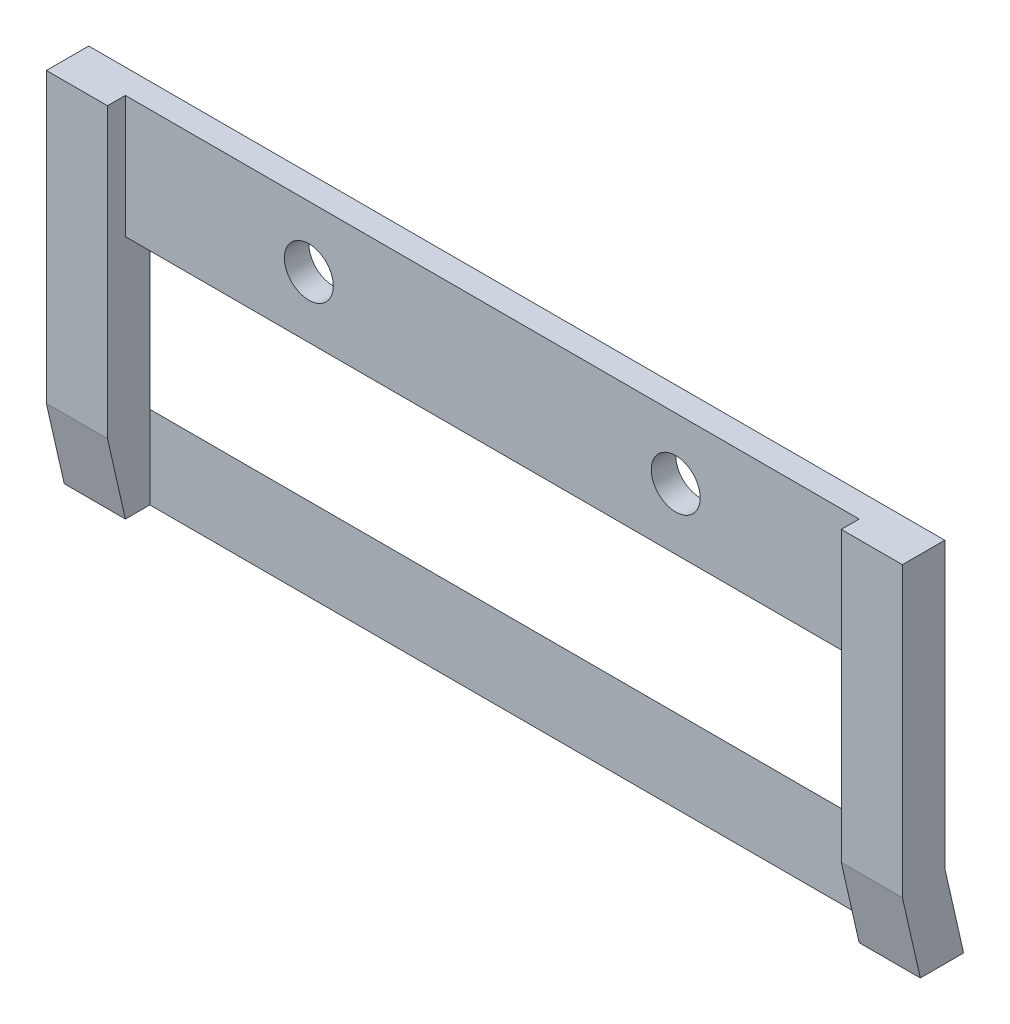
from build123d import *

# Parameters (mm, degrees)
EXTRUDE_1_DEPTH     = 2
EXTRUDE_2_DEPTH     = 5
EXTRUDE_3_DEPTH     = 5
SKETCH_4_R          = 2
CUT_EXTRUDE_1_DEPTH = 10
EXTRUDE_START       = -70
EXTRUDE_4_DEPTH     = 70


with BuildPart() as part:
    # 草图1 → 凸台-拉伸1 (new body)
    with BuildSketch(Plane.XY):
        Polygon((-44.754893935, 0), (15.245106065, 0), (15.245106065, -20), (20.245106065, -20), (20.245106065, 10), (15.245106065, 10), (-44.754893935, 10), (-49.754893935, 10), (-49.754893935, -20), (-44.754893935, -20), align=None)
    extrude(amount=EXTRUDE_1_DEPTH)

    # 草图2 → 凸台-拉伸2 (add)
    with BuildSketch(Plane.ZY.offset(49.754893935)):
        Polygon((0, 10), (0, -20), (2, -20), (3.461164558, -13.577882357), (3.461164558, 10), align=None)
    extrude(amount=-EXTRUDE_2_DEPTH)

    # 草图3 → 凸台-拉伸3 (add)
    with BuildSketch(Plane(origin=(20.245106065, 0, 0), x_dir=(0, 0, -1), z_dir=(1, 0, 0))):
        Polygon((-2, 10), (-3.461164558, 10), (-3.461164558, -13.577882357), (-2, -20), align=None)
    extrude(amount=-EXTRUDE_3_DEPTH)

    # 草图4 → 切除-拉伸1 (cut)
    with BuildSketch(Plane.XY.offset(2)):
        with Locations((-29.754893935, 5)):
            Circle(SKETCH_4_R)
    cut_extrude_1 = extrude(amount=-CUT_EXTRUDE_1_DEPTH, mode=Mode.SUBTRACT)

    # 镜向2: 切除-拉伸1 across plane
    add(cut_extrude_1.mirror(Plane.ZY.offset(14.754893935)), mode=Mode.SUBTRACT)

    # 草图5 → 凸台-拉伸4 (add)
    with BuildSketch(Plane.ZY.offset(49.754893935).offset(EXTRUDE_START)):
        Polygon((0, -13.225390566), (-1.541363729, -20), (0, -20), align=None)
    extrude_4 = extrude(amount=EXTRUDE_4_DEPTH)

    # 镜向3: 凸台-拉伸4 across plane
    add(extrude_4.mirror(Plane.ZY.offset(14.754893935)))


solid = part.part
